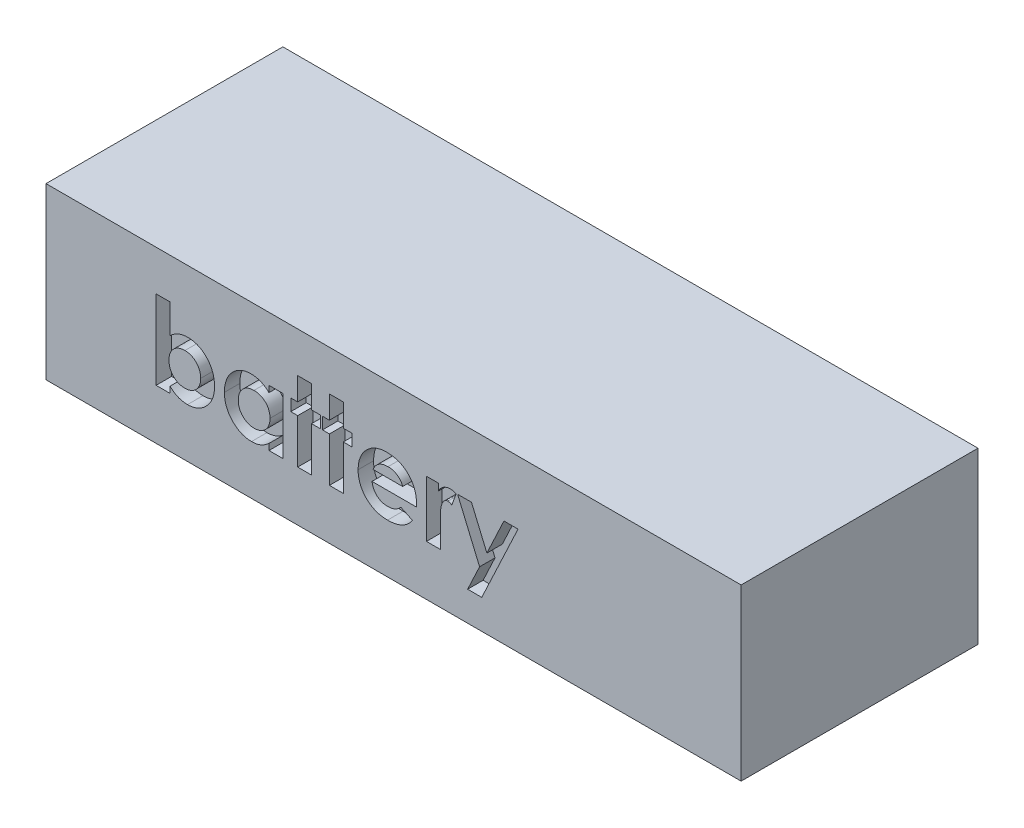
from build123d import *

# Parameters (mm, degrees)
SKETCH_1_W          = 135
SKETCH_1_H          = 33
EXTRUDE_1_DEPTH     = 46
CUT_EXTRUDE_1_DEPTH = 3


with BuildPart() as part:
    # ｽｹｯﾁ1 → ﾎﾞｽ - 押し出し1 (new body)
    with BuildSketch(Plane.XY):
        with Locations((67.5, 16.5)):
            Rectangle(SKETCH_1_W, SKETCH_1_H)
    extrude(amount=EXTRUDE_1_DEPTH)

    # ｽｹｯﾁ2 → ｶｯﾄ - 押し出し1 (cut)
    # profile 1 of 7: a face of its own
    with BuildSketch(Plane.XY.offset(46)):
        with BuildLine():
            Line((24.074722229, 25.14774532), (24.074722229, 19.447625128))
            add(Edge.make_bspline(
                [(24.074722229, 19.447625128), (24.199740685, 19.565337539), (24.445158571, 19.79641327), (24.845857096, 20.095219483), (25.260933041, 20.347409477), (25.690014561, 20.558985084), (26.136963428, 20.715436123), (26.596288067, 20.837004441), (27.072695046, 20.901389585), (27.394868954, 20.911751888), (27.557294345, 20.916976089)],
                knots=[0, 0, 0, 0, 1.061187343, 2.083167259, 3.083809127, 4.061667593, 5.035358583, 6.007314429, 6.995378812, 8, 8, 8, 8], degree=3))
            add(Edge.make_bspline(
                [(27.557294345, 20.916976089), (27.733852947, 20.912747065), (28.081616104, 20.904417261), (28.59328342, 20.826646571), (29.083624154, 20.700935602), (29.554508103, 20.525408828), (30.00342645, 20.297516625), (30.435423114, 20.024658742), (30.843047804, 19.695575564), (31.226498678, 19.322833687), (31.581200289, 18.914280901), (31.889725368, 18.470097312), (32.146714786, 17.996129229), (32.364525944, 17.497979945), (32.523493276, 16.967387819), (32.646012031, 16.41147039), (32.714286357, 15.825524477), (32.723746, 15.426355734), (32.728568383, 15.222865512)],
                knots=[0, 0, 0, 0, 0.985987466, 1.942075377, 2.884088208, 3.810275091, 4.743821533, 5.692411115, 6.659945104, 7.665215984, 8.677116751, 9.678438675, 10.680260931, 11.685531812, 12.710472044, 13.769734641, 14.863044265, 16, 16, 16, 16], degree=3))
            add(Edge.make_bspline(
                [(32.728568383, 15.222865512), (32.724004319, 15.026341303), (32.715007541, 14.638948756), (32.642319248, 14.07022462), (32.519118679, 13.526931847), (32.346293248, 13.008874775), (32.126585563, 12.514416254), (31.858417169, 12.043896993), (31.540223782, 11.598960505), (31.176446629, 11.185600535), (30.778967225, 10.811272353), (30.364822177, 10.47542555), (29.925763077, 10.200225432), (29.472765421, 9.967797849), (28.99869278, 9.790064974), (28.506783278, 9.665543118), (27.997815979, 9.582292533), (27.651780207, 9.574683754), (27.476164537, 9.570822243)],
                knots=[0, 0, 0, 0, 1.098553145, 2.165490463, 3.199345634, 4.208780719, 5.21409072, 6.219899742, 7.23156933, 8.267303578, 9.293302409, 10.281606823, 11.243293419, 12.184993323, 13.124258899, 14.066907486, 15.018941492, 16, 16, 16, 16], degree=3))
            add(Edge.make_bspline(
                [(27.476164537, 9.570822243), (27.319730468, 9.575004139), (27.011700412, 9.583238596), (26.557651289, 9.644311662), (26.121326568, 9.747024792), (25.697214428, 9.888512791), (25.284164117, 10.081826998), (24.874982354, 10.323541124), (24.467035734, 10.616713412), (24.208125782, 10.842636401), (24.074722229, 10.959043397)],
                knots=[0, 0, 0, 0, 0.996418773, 1.962021009, 2.912343664, 3.848616743, 4.805003894, 5.811808768, 6.872532775, 8, 8, 8, 8], degree=3))
            Line((24.074722229, 10.959043397), (24.074722229, 9.763129935))
            Line((24.074722229, 9.763129935), (21.382414537, 9.763129935))
            Line((21.382414537, 9.763129935), (21.382414537, 25.14774532))
            Line((21.382414537, 25.14774532), (24.074722229, 25.14774532))
        make_face()
        with BuildLine():
            add(Edge.make_bspline(
                [(26.974361653, 18.416976089), (26.865099774, 18.413616211), (26.650887096, 18.407029024), (26.33638387, 18.369277884), (26.038386525, 18.298248837), (25.752364254, 18.20618792), (25.481938922, 18.081920142), (25.224898143, 17.931282049), (24.983443495, 17.751657623), (24.756321835, 17.550159769), (24.552234967, 17.323474304), (24.370921489, 17.081249127), (24.220497806, 16.820330011), (24.095103271, 16.544025378), (24.000498573, 16.249345641), (23.930329296, 15.938797645), (23.892196742, 15.611429699), (23.885726844, 15.388220613), (23.882414537, 15.273947243)],
                knots=[0, 0, 0, 0, 1.060469436, 2.079096586, 3.066888298, 4.028858836, 4.99004353, 5.948472697, 6.914558426, 7.905691313, 8.889602648, 9.869280844, 10.836099585, 11.806137001, 12.808075328, 13.83377171, 14.890985086, 16, 16, 16, 16], degree=3))
            add(Edge.make_bspline(
                [(23.882414537, 15.273947243), (23.885768523, 15.157673996), (23.892350864, 14.929482742), (23.930165535, 14.595134114), (23.999842295, 14.278364407), (24.096439546, 13.978455425), (24.219700324, 13.695368255), (24.369945783, 13.428053453), (24.553255054, 13.182371758), (24.755099952, 12.949709575), (24.983625962, 12.745515637), (25.223992851, 12.562381763), (25.481876475, 12.411519127), (25.753594179, 12.289284732), (26.037084193, 12.187708619), (26.336571059, 12.119073744), (26.650837426, 12.080622492), (26.865082997, 12.07413253), (26.974361653, 12.070822243)],
                knots=[0, 0, 0, 0, 1.117193555, 2.192540452, 3.22680955, 4.227918444, 5.21468246, 6.188555072, 7.166222992, 8.154674427, 9.142376254, 10.104580718, 11.053462639, 12.005072638, 12.963662044, 13.941614018, 14.950094269, 16, 16, 16, 16], degree=3))
            add(Edge.make_bspline(
                [(26.974361653, 12.070822243), (27.079665331, 12.073897398), (27.288106209, 12.079984442), (27.593090526, 12.122457697), (27.886256438, 12.191863216), (28.165308067, 12.290791188), (28.43194411, 12.419595308), (28.688591945, 12.570317446), (28.926391124, 12.758633506), (29.154670906, 12.965608932), (29.358920323, 13.199017685), (29.542156597, 13.446983743), (29.696080512, 13.711720254), (29.818292473, 13.994105123), (29.919328586, 14.28878957), (29.988309127, 14.60116734), (30.026260957, 14.928450238), (30.032894331, 15.151657649), (30.036260691, 15.26493282)],
                knots=[0, 0, 0, 0, 1.021711385, 2.02240246, 2.981887075, 3.941027022, 4.888772411, 5.852236371, 6.822344989, 7.82661704, 8.838806642, 9.826383926, 10.814965113, 11.80282933, 12.807900643, 13.833672313, 14.900613836, 16, 16, 16, 16], degree=3))
            add(Edge.make_bspline(
                [(30.036260691, 15.26493282), (30.032840572, 15.377188896), (30.026101979, 15.598364795), (29.988927322, 15.922922302), (29.917290925, 16.230758637), (29.826840855, 16.524388597), (29.700473999, 16.799989885), (29.551057934, 17.060822821), (29.37524225, 17.30767497), (29.171288482, 17.533882533), (28.947587146, 17.739715164), (28.708789779, 17.921775824), (28.455834161, 18.076761318), (28.185275591, 18.198984936), (27.903498823, 18.299548632), (27.606197721, 18.368818236), (27.294883736, 18.40715591), (27.082637311, 18.413658731), (26.974361653, 18.416976089)],
                knots=[0, 0, 0, 0, 1.094680664, 2.156827393, 3.177782763, 4.17210342, 5.146667393, 6.126451192, 7.099203661, 8.094961544, 9.09004898, 10.058676268, 11.018205477, 11.974998356, 12.947750825, 13.930643515, 14.944335875, 16, 16, 16, 16], degree=3))
        make_face(mode=Mode.SUBTRACT)
    # profile 2 of 7: a face of its own
    with BuildSketch(Plane.XY.offset(46)):
        with BuildLine():
            Line((43.30549146, 20.724668397), (45.997799153, 20.724668397))
            Line((45.997799153, 20.724668397), (45.997799153, 9.763129935))
            Line((45.997799153, 9.763129935), (43.30549146, 9.763129935))
            Line((43.30549146, 9.763129935), (43.30549146, 10.959043397))
            add(Edge.make_bspline(
                [(43.30549146, 10.959043397), (43.172088606, 10.842634457), (42.91318001, 10.616707694), (42.505223842, 10.323561975), (42.096075578, 10.081754643), (41.683769251, 9.88916829), (41.261967884, 9.74696309), (40.827634678, 9.644003204), (40.374514772, 9.58328524), (40.066490102, 9.575019849), (39.910058768, 9.570822243)],
                knots=[0, 0, 0, 0, 1.129196829, 2.191548051, 3.199897424, 4.157751732, 5.089409408, 6.034969131, 7.002052659, 8, 8, 8, 8], degree=3))
            add(Edge.make_bspline(
                [(39.910058768, 9.570822243), (39.734457642, 9.574772719), (39.387459864, 9.582579084), (38.878279148, 9.664753667), (38.386614546, 9.790540183), (37.912865152, 9.968543825), (37.457892911, 10.199201648), (37.018215905, 10.476495468), (36.601371537, 10.810159956), (36.203889722, 11.1857583), (35.839957755, 11.598919151), (35.521804995, 12.043907893), (35.253625863, 12.514413342), (35.033921051, 13.008875558), (34.861094844, 13.526931632), (34.737894488, 14.07022468), (34.665206137, 14.638948741), (34.656209367, 15.026341298), (34.651645306, 15.222865512)],
                knots=[0, 0, 0, 0, 0.980476535, 1.937477201, 2.874147792, 3.812856188, 4.758993464, 5.720109578, 6.712210464, 7.737600662, 8.772720504, 9.783789959, 10.789002326, 11.793715968, 12.802552247, 13.835794126, 14.902098527, 16, 16, 16, 16], degree=3))
            add(Edge.make_bspline(
                [(34.651645306, 15.222865512), (34.656435305, 15.426366594), (34.665831421, 15.825556642), (34.734563449, 16.411349057), (34.855490294, 16.968113012), (35.02038274, 17.496619706), (35.23248824, 17.996960444), (35.490818566, 18.469954945), (35.798888061, 18.914366876), (36.153883542, 19.322632035), (36.537191469, 19.696826773), (36.947263189, 20.022592967), (37.377686076, 20.299346506), (37.82891753, 20.525284794), (38.300893112, 20.699878468), (38.791749471, 20.827520701), (39.303665663, 20.904110523), (39.652387121, 20.912651952), (39.82892896, 20.916976089)],
                knots=[0, 0, 0, 0, 1.136281865, 2.228943489, 3.287578264, 4.313574083, 5.316051562, 6.317280042, 7.318008486, 8.329309503, 9.333984563, 10.305318864, 11.248632312, 12.186624717, 13.117503092, 14.05354244, 15.014596925, 16, 16, 16, 16], degree=3))
            add(Edge.make_bspline(
                [(39.82892896, 20.916976089), (39.992463906, 20.913578616), (40.316040619, 20.906856243), (40.791651764, 20.833864127), (41.252925978, 20.723468735), (41.697346987, 20.566175173), (42.128560078, 20.367560051), (42.539148116, 20.118680498), (42.938093084, 19.829996812), (43.18151224, 19.604528738), (43.30549146, 19.489692435)],
                knots=[0, 0, 0, 0, 1.017011718, 2.012299608, 2.98747302, 3.965332399, 4.941441765, 5.936729654, 6.94912688, 8, 8, 8, 8], degree=3))
            Line((43.30549146, 19.489692435), (43.30549146, 20.724668397))
        make_face()
        with BuildLine():
            add(Edge.make_bspline(
                [(40.393832806, 18.416976089), (40.286552281, 18.413684352), (40.076289457, 18.407232763), (39.767069199, 18.368426004), (39.471547394, 18.300046764), (39.191831682, 18.199031122), (38.923753269, 18.075979352), (38.671382969, 17.921859035), (38.432637894, 17.739692096), (38.208922127, 17.533888793), (38.004972244, 17.307673336), (37.829155541, 17.060823258), (37.679739748, 16.799989768), (37.553372819, 16.524388629), (37.462922769, 16.230758628), (37.391286367, 15.922922305), (37.354111711, 15.598364794), (37.347373118, 15.377188896), (37.343952999, 15.26493282)],
                knots=[0, 0, 0, 0, 1.04836806, 2.054732945, 3.03993516, 4.00574415, 4.955904794, 5.917688631, 6.888591924, 7.88601754, 8.884115178, 9.859153345, 10.841239365, 11.818093293, 12.814750328, 13.83810466, 14.90274714, 16, 16, 16, 16], degree=3))
            add(Edge.make_bspline(
                [(37.343952999, 15.26493282), (37.347320875, 15.151658516), (37.353957236, 14.928452815), (37.391887445, 14.601157546), (37.460946074, 14.288824457), (37.561700009, 13.993978549), (37.684743936, 13.712641376), (37.834516065, 13.446111335), (38.018484893, 13.199101011), (38.222613561, 12.965765309), (38.450918821, 12.757405584), (38.691014813, 12.572401277), (38.946181058, 12.417608292), (39.213649182, 12.292503623), (39.492518876, 12.190553833), (39.78628632, 12.123033981), (40.092073692, 12.079869817), (40.300537018, 12.073858926), (40.405852037, 12.070822243)],
                knots=[0, 0, 0, 0, 1.099136573, 2.165835871, 3.191374663, 4.196217796, 5.183857741, 6.167377911, 7.154730987, 8.166690795, 9.170734848, 10.148332609, 11.103258353, 12.059567475, 13.009337315, 13.978056681, 14.978520572, 16, 16, 16, 16], degree=3))
            add(Edge.make_bspline(
                [(40.405852037, 12.070822243), (40.515130787, 12.074132434), (40.729376544, 12.080622208), (41.043641574, 12.119074814), (41.343133296, 12.187704772), (41.626605664, 12.289298751), (41.898388449, 12.411467253), (42.156029055, 12.562575941), (42.396731692, 12.744324857), (42.621715411, 12.951988628), (42.827869618, 13.180051271), (43.006117727, 13.430138395), (43.161378351, 13.694251527), (43.283483688, 13.978635265), (43.380452449, 14.278314221), (43.450025299, 14.595148265), (43.487868896, 14.929478984), (43.494447216, 15.157672727), (43.497799153, 15.273947243)],
                knots=[0, 0, 0, 0, 1.050008698, 2.058587853, 3.036635738, 3.995319155, 4.947022481, 5.895997462, 6.858296291, 7.838991643, 8.833936038, 9.806048392, 10.784806122, 11.771666913, 12.772873988, 13.80724452, 14.882696879, 16, 16, 16, 16], degree=3))
            add(Edge.make_bspline(
                [(43.497799153, 15.273947243), (43.494488867, 15.388221892), (43.488022917, 15.611433478), (43.44986209, 15.938783529), (43.379795312, 16.249396399), (43.284822328, 16.543843036), (43.160544699, 16.82145019), (43.005166601, 17.07913986), (42.828873771, 17.325840028), (42.620437139, 17.547741436), (42.396672209, 17.753901562), (42.152429648, 17.930154258), (41.895404425, 18.082053724), (41.624017371, 18.206769042), (41.335755564, 18.298190099), (41.03575203, 18.368974078), (40.719326093, 18.407209472), (40.504101129, 18.413667423), (40.393832806, 18.416976089)],
                knots=[0, 0, 0, 0, 1.106611376, 2.161533483, 3.185006901, 4.184773755, 5.152708835, 6.122342771, 7.094156588, 8.082475533, 9.064254463, 10.03606828, 10.992420271, 11.951521816, 12.920622147, 13.915721683, 14.932141191, 16, 16, 16, 16], degree=3))
        make_face(mode=Mode.SUBTRACT)
    # profile 3 of 7: a face of its own
    with BuildSketch(Plane.XY.offset(46)):
        Polygon((48.882414537, 25.14774532), (51.574722229, 25.14774532), (51.574722229, 20.724668397), (53.30549146, 20.724668397), (53.30549146, 18.416976089), (51.574722229, 18.416976089), (51.574722229, 9.763129935), (48.882414537, 9.763129935), (48.882414537, 18.416976089), (47.536260691, 18.416976089), (47.536260691, 20.724668397), (48.882414537, 20.724668397), align=None)
    # profile 4 of 7: a face of its own
    with BuildSketch(Plane.XY.offset(46)):
        Polygon((55.036260691, 25.14774532), (57.728568383, 25.14774532), (57.728568383, 20.724668397), (59.459337614, 20.724668397), (59.459337614, 18.416976089), (57.728568383, 18.416976089), (57.728568383, 9.763129935), (55.036260691, 9.763129935), (55.036260691, 18.416976089), (53.690106845, 18.416976089), (53.690106845, 20.724668397), (55.036260691, 20.724668397), align=None)
    # profile 5 of 7: a face of its own
    with BuildSketch(Plane.XY.offset(46)):
        with BuildLine():
            Line((71.950323191, 14.570822243), (63.30549146, 14.570822243))
            add(Edge.make_bspline(
                [(63.30549146, 14.570822243), (63.323117574, 14.470374203), (63.357754278, 14.272985878), (63.432969113, 13.98626221), (63.528954523, 13.716058664), (63.643986992, 13.462014045), (63.776127073, 13.222785319), (63.930257531, 12.999494561), (64.10442336, 12.792338999), (64.29761758, 12.60221895), (64.506619995, 12.431867266), (64.73041702, 12.282628421), (64.969239598, 12.160261698), (65.220349721, 12.057119249), (65.485623757, 11.975419979), (65.765452124, 11.919073547), (66.059093039, 11.885789503), (66.2591302, 11.880975347), (66.361380883, 11.878514551)],
                knots=[0, 0, 0, 0, 1.091296461, 2.144483647, 3.168565212, 4.157007626, 5.126487748, 6.090021542, 7.05641414, 8.019231907, 8.98705074, 9.938580405, 10.892824166, 11.854447369, 12.841318655, 13.858982407, 14.905600794, 16, 16, 16, 16], degree=3))
            add(Edge.make_bspline(
                [(66.361380883, 11.878514551), (66.484804399, 11.881773051), (66.727861648, 11.888189997), (67.083942328, 11.945098779), (67.428324215, 12.031056992), (67.757748243, 12.158884071), (68.076030272, 12.318006314), (68.377930402, 12.516253049), (68.668674288, 12.74783086), (68.846062322, 12.926330947), (68.936501076, 13.017336666)],
                knots=[0, 0, 0, 0, 1.021034703, 2.010718019, 2.977989445, 3.954245119, 4.929443971, 5.918328161, 6.938689359, 8, 8, 8, 8], degree=3))
            Line((68.936501076, 13.017336666), (71.190106845, 11.94462032))
            add(Edge.make_bspline(
                [(71.190106845, 11.94462032), (71.119153382, 11.846573525), (70.978561706, 11.652297405), (70.749050513, 11.37890073), (70.509540968, 11.123810541), (70.259854446, 10.888704605), (69.999674282, 10.674252881), (69.729724234, 10.477842959), (69.446059093, 10.304748368), (69.154350691, 10.146594895), (68.848568877, 10.011010657), (68.529559885, 9.895389204), (68.198674894, 9.790868394), (67.851735545, 9.711229263), (67.491630796, 9.648187576), (67.117499208, 9.603419627), (66.729390088, 9.57576861), (66.465594581, 9.572490616), (66.331332806, 9.570822243)],
                knots=[0, 0, 0, 0, 1.028154879, 2.037251081, 3.030720504, 4.000128189, 4.949298328, 5.894184978, 6.834267904, 7.770992897, 8.712077017, 9.673380525, 10.653304757, 11.658697181, 12.695551717, 13.758623199, 14.859225354, 16, 16, 16, 16], degree=3))
            add(Edge.make_bspline(
                [(66.331332806, 9.570822243), (66.124773271, 9.57503337), (65.720238326, 9.583280621), (65.12853284, 9.659826908), (64.566576745, 9.786748904), (64.032783271, 9.959279863), (63.52945983, 10.18707478), (63.056357326, 10.46568686), (62.608748788, 10.789774551), (62.200311156, 11.166139592), (61.828212423, 11.575790563), (61.501384032, 12.015727733), (61.227898688, 12.482877426), (61.003307023, 12.974147949), (60.828746579, 13.49079676), (60.702898624, 14.033049316), (60.62575232, 14.600646626), (60.617420136, 14.987243754), (60.613183768, 15.183803012)],
                knots=[0, 0, 0, 0, 1.103565453, 2.161269334, 3.182010356, 4.179077853, 5.15417608, 6.128274628, 7.109042802, 8.101804412, 9.090965879, 10.063106201, 11.02526161, 11.978650795, 12.945248442, 13.93468508, 14.949922959, 16, 16, 16, 16], degree=3))
            add(Edge.make_bspline(
                [(60.613183768, 15.183803012), (60.617461831, 15.385357093), (60.625878728, 15.781905696), (60.702234395, 16.362609087), (60.829094506, 16.916678666), (61.004165577, 17.444877445), (61.225350159, 17.948857403), (61.502315134, 18.424209319), (61.828050236, 18.87258811), (62.198808491, 19.291896216), (62.60897639, 19.670367591), (63.044818535, 20.007661221), (63.511232059, 20.288716662), (64.002941423, 20.515809284), (64.516801476, 20.700316307), (65.058751723, 20.823090321), (65.624668749, 20.905525723), (66.011517165, 20.913117509), (66.208135691, 20.916976089)],
                knots=[0, 0, 0, 0, 1.079208495, 2.12329425, 3.130605359, 4.119693003, 5.099659317, 6.073216462, 7.060498243, 8.06384408, 9.066070512, 10.045757761, 11.010926815, 11.975797609, 12.942977511, 13.929384301, 14.947594487, 16, 16, 16, 16], degree=3))
            add(Edge.make_bspline(
                [(66.208135691, 20.916976089), (66.415684787, 20.912699629), (66.823186047, 20.904303241), (67.419012579, 20.828378491), (67.984699995, 20.700682541), (68.522658441, 20.529643424), (69.026017967, 20.296094169), (69.505838907, 20.024338291), (69.950612435, 19.693245198), (70.365079363, 19.318721967), (70.739220471, 18.903201421), (71.066261255, 18.451818843), (71.344532711, 17.968979463), (71.570074487, 17.452725263), (71.744455689, 16.904606089), (71.870420139, 16.325333782), (71.946978001, 15.712705067), (71.955155142, 15.293203075), (71.959337614, 15.078634743)],
                knots=[0, 0, 0, 0, 1.080001299, 2.120471247, 3.119684163, 4.095710327, 5.052285597, 6.002875087, 6.961153713, 7.931888285, 8.906493152, 9.865905668, 10.82813294, 11.801621613, 12.7925306, 13.817193356, 14.883530496, 16, 16, 16, 16], degree=3))
            Line((71.959337614, 15.078634743), (71.950323191, 14.570822243))
        make_face()
        with BuildLine():
            add(Edge.make_bspline(
                [(69.267029922, 16.686206858), (69.216224429, 16.823310303), (69.115209874, 17.095907667), (68.8870222, 17.472025514), (68.584224456, 17.797758846), (68.232048958, 18.086133147), (67.8296664, 18.320195743), (67.38975656, 18.489664664), (66.917879815, 18.591280356), (66.593254042, 18.603198091), (66.427486653, 18.609283781)],
                knots=[0, 0, 0, 0, 0.954238005, 1.897273737, 2.851915805, 3.847685534, 4.862635127, 5.880135777, 6.917509367, 8, 8, 8, 8], degree=3))
            add(Edge.make_bspline(
                [(66.427486653, 18.609283781), (66.246441674, 18.603437735), (65.892536438, 18.592009932), (65.38205223, 18.470471047), (64.900525251, 18.289077892), (64.616644236, 18.102057698), (64.474361653, 18.008322243)],
                knots=[0, 0, 0, 0, 1.044195649, 2.041185066, 3.018232172, 4, 4, 4, 4], degree=3))
            add(Edge.make_bspline(
                [(64.474361653, 18.008322243), (64.385587947, 17.936931267), (64.196326946, 17.784729356), (63.950533139, 17.481100993), (63.708424193, 17.113475206), (63.570771909, 16.834237448), (63.497799153, 16.686206858)],
                knots=[0, 0, 0, 0, 0.82159062, 1.751589201, 2.808063854, 4, 4, 4, 4], degree=3))
            Line((63.497799153, 16.686206858), (69.267029922, 16.686206858))
        make_face(mode=Mode.SUBTRACT)
    # profile 6 of 7: a face of its own
    with BuildSketch(Plane.XY.offset(46)):
        with BuildLine():
            Line((73.882414537, 20.724668397), (76.190106845, 20.724668397))
            Line((76.190106845, 20.724668397), (76.190106845, 19.375509743))
            add(Edge.make_bspline(
                [(76.190106845, 19.375509743), (76.25538703, 19.495409844), (76.38297986, 19.729759565), (76.617378591, 20.044327657), (76.886665345, 20.309248127), (77.181163819, 20.530062028), (77.501766579, 20.702164783), (77.839888455, 20.824809692), (78.192636819, 20.904511888), (78.433269795, 20.912791439), (78.554890499, 20.916976089)],
                knots=[0, 0, 0, 0, 1.09866127, 2.147379032, 3.14564304, 4.131443017, 5.102343063, 6.064490016, 7.021754664, 8, 8, 8, 8], degree=3))
            add(Edge.make_bspline(
                [(78.554890499, 20.916976089), (78.643202305, 20.91284078), (78.823036678, 20.904419815), (79.097129568, 20.855468618), (79.375177137, 20.766955545), (79.558156397, 20.687261286), (79.651645306, 20.646543397)],
                knots=[0, 0, 0, 0, 0.931404136, 1.896671404, 2.925354185, 4, 4, 4, 4], degree=3))
            Line((79.651645306, 20.646543397), (78.816308768, 18.365894358))
            add(Edge.make_bspline(
                [(78.816308768, 18.365894358), (78.74164161, 18.401969919), (78.601296096, 18.469778085), (78.397538779, 18.549798707), (78.212620566, 18.59862338), (78.095385813, 18.605908449), (78.041068383, 18.609283781)],
                knots=[0, 0, 0, 0, 1.214386998, 2.282580073, 3.20428172, 4, 4, 4, 4], degree=3))
            add(Edge.make_bspline(
                [(78.041068383, 18.609283781), (77.989782167, 18.607047108), (77.888893342, 18.602647186), (77.73998426, 18.56494135), (77.599742913, 18.499918804), (77.461411078, 18.416618469), (77.335901604, 18.300824774), (77.210469655, 18.166773011), (77.099932305, 18.001268281), (76.983283343, 17.81705311), (76.883960924, 17.591573907), (76.798795007, 17.322398204), (76.722911492, 17.006411455), (76.670693273, 16.641935922), (76.620222267, 16.232498537), (76.590180686, 15.77509408), (76.567790315, 15.271168907), (76.566421294, 14.91941095), (76.565707806, 14.736086666)],
                knots=[0, 0, 0, 0, 0.544232178, 1.070598461, 1.618251235, 2.182094276, 2.777567932, 3.425210017, 4.127676488, 4.886675562, 5.738955394, 6.734782583, 7.883056018, 9.186093582, 10.642914445, 12.264202625, 14.053029461, 16, 16, 16, 16], degree=3))
            Line((76.565707806, 14.736086666), (76.574722229, 14.201230897))
            Line((76.574722229, 14.201230897), (76.574722229, 9.763129935))
            Line((76.574722229, 9.763129935), (73.882414537, 9.763129935))
            Line((73.882414537, 9.763129935), (73.882414537, 20.724668397))
        make_face()
    # profile 7 of 7: a face of its own
    with BuildSketch(Plane.XY.offset(46)):
        Polygon((79.934097229, 20.724668397), (82.629409729, 20.724668397), (85.622198191, 13.672384743), (88.933496268, 20.724668397), (91.670876076, 20.724668397), (84.624602037, 5.724668397), (81.887222229, 5.724668397), (84.20392896, 10.65555782), align=None)
    extrude(amount=-CUT_EXTRUDE_1_DEPTH, mode=Mode.SUBTRACT)


solid = part.part
